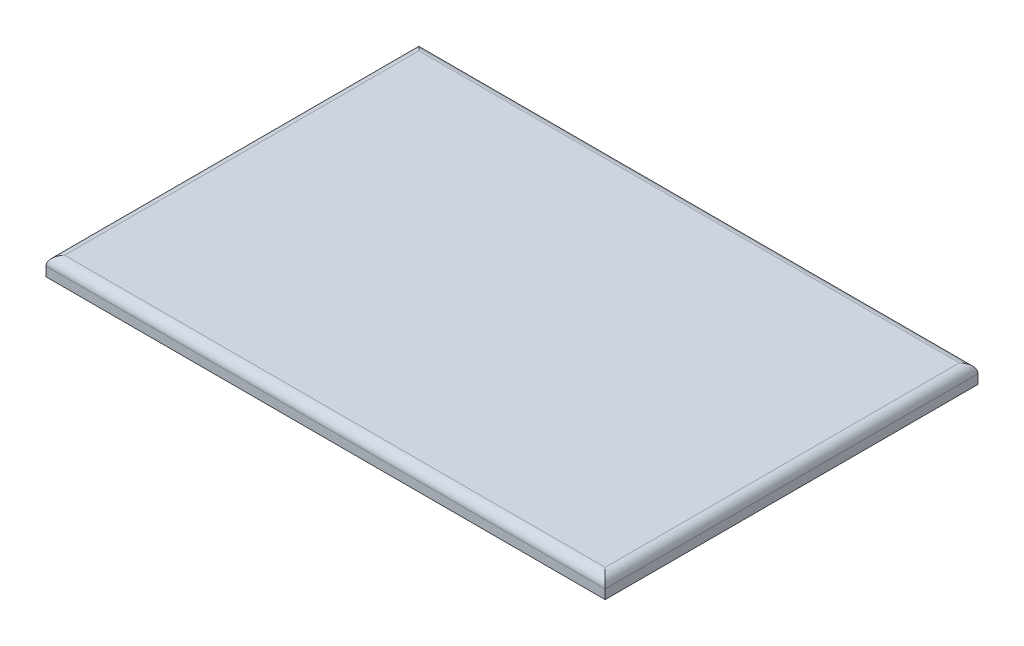
from build123d import *

# Parameters (mm, degrees)
SKETCH1_W           = 60
SKETCH1_H           = 40
BOSS_EXTRUDE1_DEPTH = 2
SKETCH2_W           = 57
SKETCH2_H           = 37
BOSS_EXTRUDE2_DEPTH = 2
FILLET1_R           = 1
FILLET2_R           = 1


with BuildPart() as part:
    # Sketch1 → Boss-Extrude1 (new body)
    with BuildSketch(Plane(origin=(0, 0, 0), x_dir=(1, 0, 0), z_dir=(0, 1, 0))):
        Rectangle(SKETCH1_W, SKETCH1_H)
    extrude(amount=BOSS_EXTRUDE1_DEPTH)

    # Sketch2 → Boss-Extrude2 (add)
    with BuildSketch(Plane(origin=(0, 0, 0), x_dir=(1, 0, 0), z_dir=(0, 1, 0))):
        Rectangle(SKETCH2_W, SKETCH2_H)
    extrude(amount=-BOSS_EXTRUDE2_DEPTH)

    # Fillet1
    fillet1_edges = [part.edges().sort_by_distance(p)[0] for p in [
        (-30, 2, 0),
        (0, 2, 20),
        (30, 2, 0),
        (0, 2, -20),
    ]]
    fillet(fillet1_edges, radius=FILLET1_R)

    # Fillet2
    fillet2_edges = [part.edges().sort_by_distance(p)[0] for p in [
        (28.5, -2, 0),
        (0, -2, 18.5),
        (-28.5, -2, 0),
        (0, -2, -18.5),
    ]]
    fillet(fillet2_edges, radius=FILLET2_R)


solid = part.part
